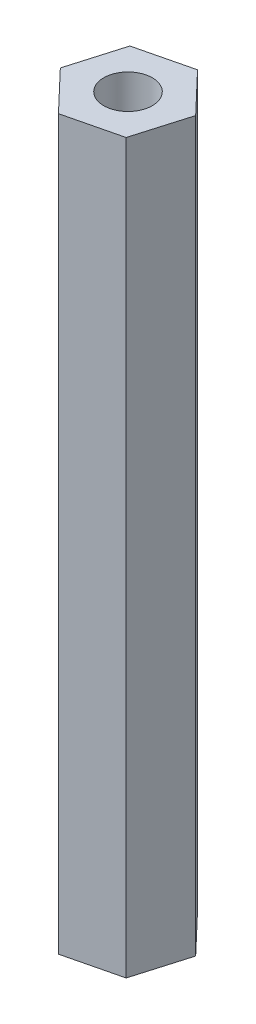
from build123d import *

# Parameters (mm, degrees)
SKETCH_1_R      = 1.5
EXTRUDE_1_DEPTH = 45


with BuildPart() as part:
    # 草图1 → 凸台-拉伸1 (new body)
    with BuildSketch(Plane(origin=(0, 0, 0), x_dir=(1, 0, 0), z_dir=(0, 1, 0))):
        Polygon((2.390960794, -2.506652445), (3.366305093, 0.817306564), (0.975344299, 3.32395901), (-2.390960794, 2.506652445), (-3.366305093, -0.817306564), (-0.975344299, -3.32395901), align=None)
        with Locations(Location((0, 0, 0), (0, 0, 90))):
            Circle(SKETCH_1_R, mode=Mode.SUBTRACT)
    extrude(amount=EXTRUDE_1_DEPTH)


solid = part.part
